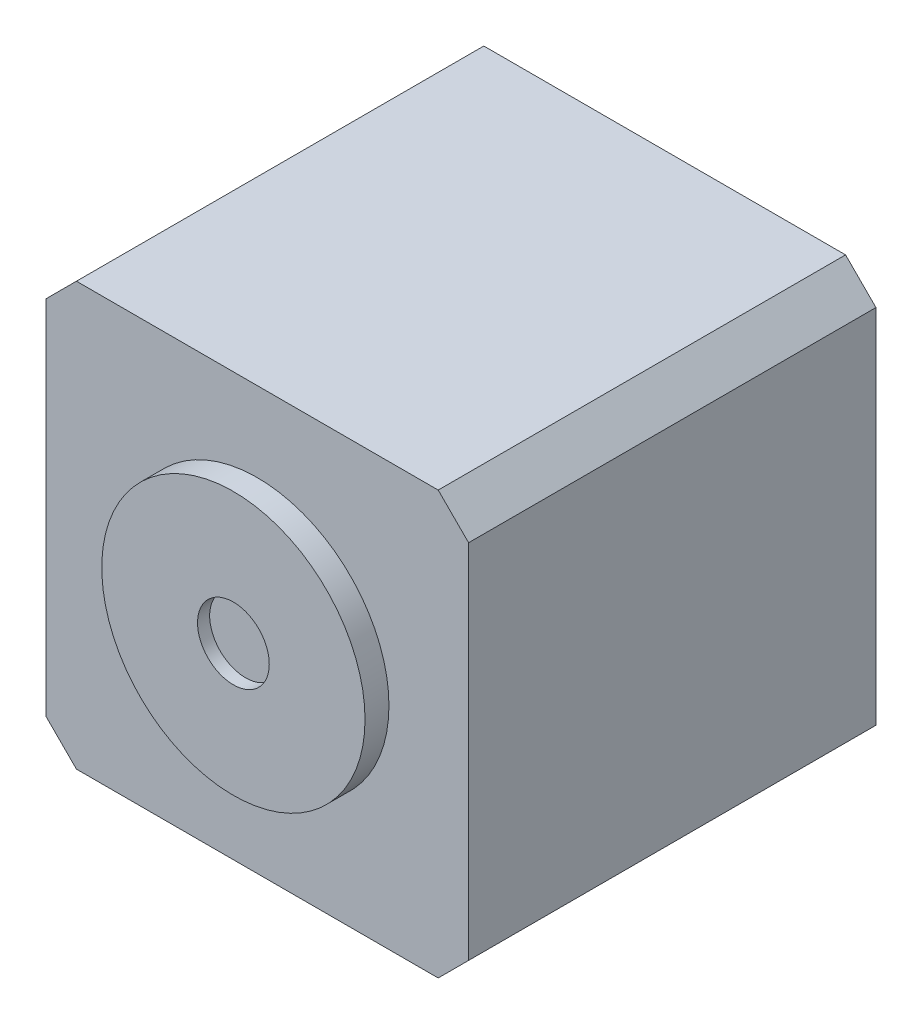
from build123d import *

# Parameters (mm, degrees)
SKETCH1_W           = 35.306
SKETCH1_H           = 35.306
BOSS_EXTRUDE1_DEPTH = 34.036
SKETCH2_R           = 10.9982
BOSS_EXTRUDE2_DEPTH = 1.99898
SKETCH3_R           = 2.9972
CUT_EXTRUDE1_DEPTH  = 1.016
CHAMFER1_SIZE       = 2.54


with BuildPart() as part:
    # Sketch1 → Boss-Extrude1 (new body)
    with BuildSketch(Plane.XY):
        Rectangle(SKETCH1_W, SKETCH1_H)
    extrude(amount=BOSS_EXTRUDE1_DEPTH)

    # Sketch2 → Boss-Extrude2 (add)
    with BuildSketch(Plane.XY.offset(34.036)):
        Circle(SKETCH2_R)
    extrude(amount=BOSS_EXTRUDE2_DEPTH)

    # Sketch3 → Cut-Extrude1 (cut)
    with BuildSketch(Plane.XY.offset(36.03498)):
        Circle(SKETCH3_R)
    extrude(amount=-CUT_EXTRUDE1_DEPTH, mode=Mode.SUBTRACT)

    # Chamfer1
    chamfer1_edges = [part.edges().sort_by_distance(p)[0] for p in [
        (-17.653, 17.653, 17.018),
        (17.653, 17.653, 17.018),
        (17.653, -17.653, 17.018),
        (-17.653, -17.653, 17.018),
    ]]
    chamfer(chamfer1_edges, length=CHAMFER1_SIZE)


solid = part.part
